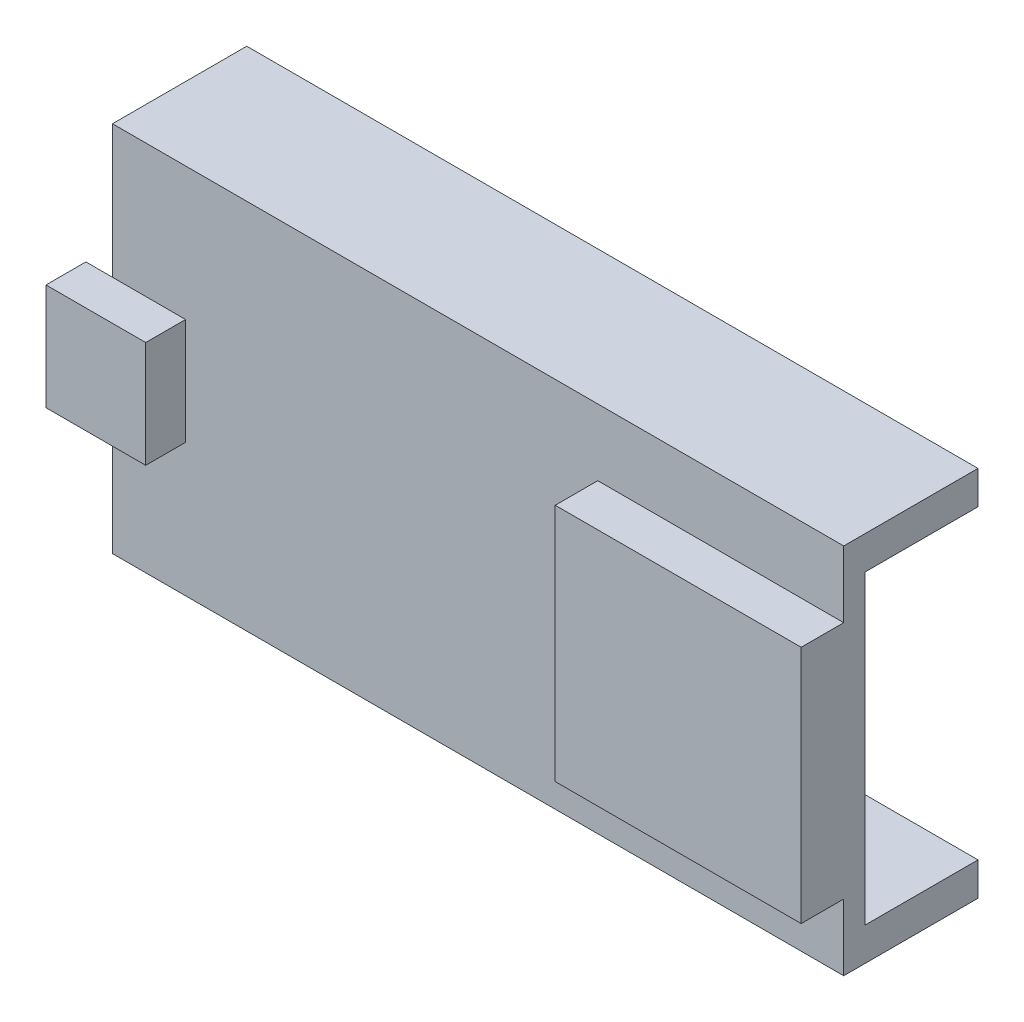
from build123d import *

# Parameters (mm, degrees)
SKETCH1_W          = 55
SKETCH1_H          = 28
PCB_DEPTH          = 1.6
SKETCH2_W          = 55
SKETCH2_H          = 2.5
HEADER_A_DEPTH     = 8.5
SKETCH3_W          = 55
SKETCH3_H          = 2.5
HEADER_B_DEPTH     = 8.5
SKETCH4_W          = 18.5
SKETCH4_H          = 18
WROOM_MODULE_DEPTH = 3.2
SKETCH5_W          = 7.5
SKETCH5_H          = 8
USB_DEPTH          = 3


with BuildPart() as part:
    # Sketch1 → PCB (new body)
    with BuildSketch(Plane.XY):
        Rectangle(SKETCH1_W, SKETCH1_H)
    extrude(amount=PCB_DEPTH)

    # Sketch2 → Header_A (add)
    with BuildSketch(Plane.XY.offset(-8.5)):
        with Locations((0, -12.75)):
            Rectangle(SKETCH2_W, SKETCH2_H)
    extrude(amount=HEADER_A_DEPTH)

    # Sketch3 → Header_B (add)
    with BuildSketch(Plane.XY.offset(-8.5)):
        with Locations((0, 12.75)):
            Rectangle(SKETCH3_W, SKETCH3_H)
    extrude(amount=HEADER_B_DEPTH)

    # Sketch4 → WROOM_module (add)
    with BuildSketch(Plane.XY.offset(1.6)):
        with Locations((18.25, 0)):
            Rectangle(SKETCH4_W, SKETCH4_H)
    extrude(amount=WROOM_MODULE_DEPTH)

    # Sketch5 → USB (add)
    with BuildSketch(Plane.XY.offset(1.6)):
        with Locations((-25.75, 0)):
            Rectangle(SKETCH5_W, SKETCH5_H)
    extrude(amount=USB_DEPTH)


solid = part.part
